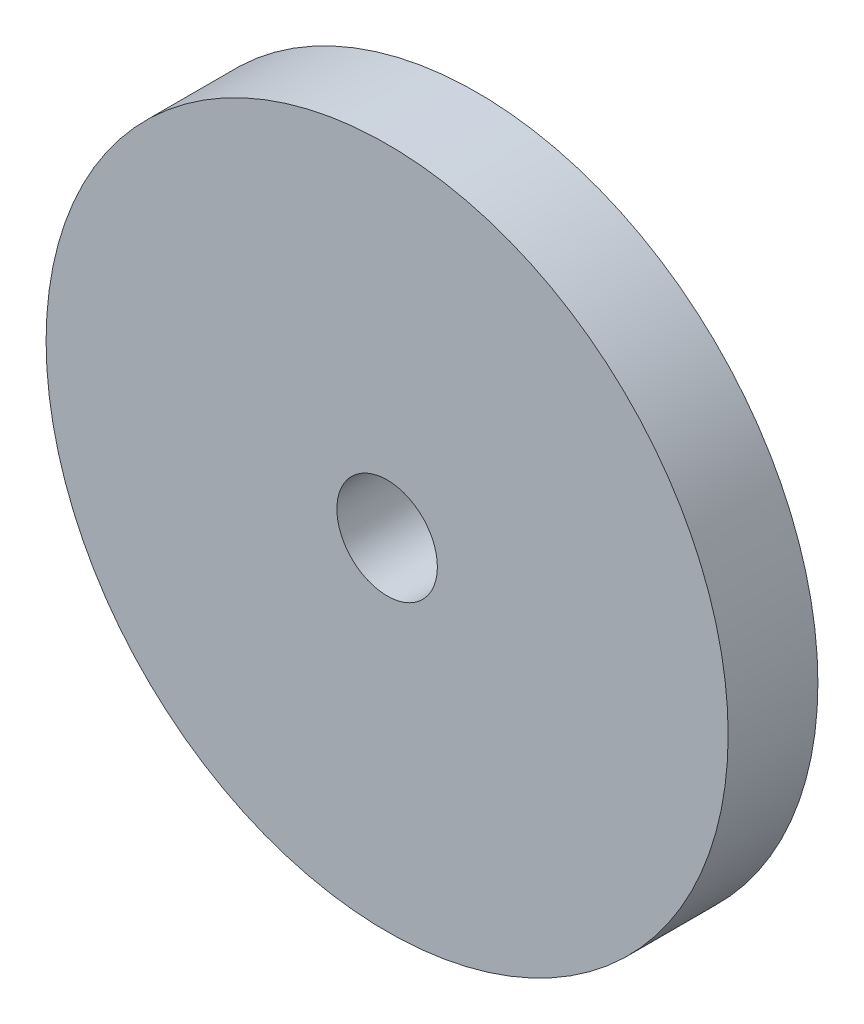
from build123d import *

# Parameters (mm, degrees)
SKETCH1_R           = 19
SKETCH1_R_2         = 2.8
BOSS_EXTRUDE1_DEPTH = 2.5


with BuildPart() as part:
    # Sketch1 → Boss-Extrude1 (new, symmetric)
    with BuildSketch(Plane.XY):
        Circle(SKETCH1_R)
        Circle(SKETCH1_R_2, mode=Mode.SUBTRACT)
    extrude(amount=BOSS_EXTRUDE1_DEPTH, both=True)


solid = part.part
